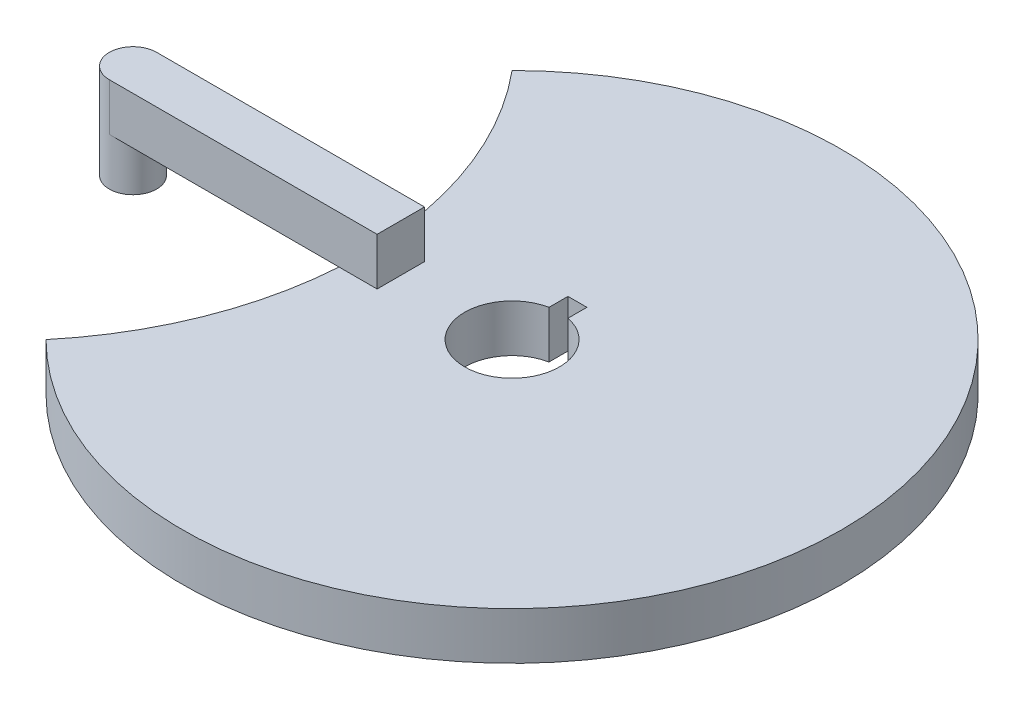
from build123d import *

# Parameters (mm, degrees)
EXTRUDE_1_DEPTH = 10
EXTRUDE_5_DEPTH = 10
EXTRUDE_START   = 10
SKETCH_5_R      = 5
EXTRUDE_6_DEPTH = 10


with BuildPart() as part:
    # 草图1 → 凸台-拉伸1 (new body)
    with BuildSketch(Plane(origin=(0, 0, 0), x_dir=(1, 0, 0), z_dir=(0, 1, 0))):
        with BuildLine():
            ThreePointArc((-49.180194883, -49.180194883), (69.551298604, 0), (-49.180194883, 49.180194883))
            ThreePointArc((-49.180194883, 49.180194883), (-31.357669024, 0), (-49.180194883, -49.180194883))
        make_face()
        with BuildLine():
            Line((-2, 9.797958971), (-2, 13.797958971))
            Line((-2, 13.797958971), (2, 13.797958971))
            Line((2, 13.797958971), (2, 9.797958971))
            ThreePointArc((2, 9.797958971), (0, -10), (-2, 9.797958971))
        make_face(mode=Mode.SUBTRACT)
    extrude(amount=EXTRUDE_1_DEPTH)

    # 草图4 → 凸台-拉伸5 (add)
    with BuildSketch(Plane(origin=(0, 10, 0), x_dir=(1, 0, 0), z_dir=(0, 1, 0))):
        with BuildLine():
            Line((-80, 5), (-23.481338819, 5))
            Line((-23.481338819, 5), (-23.481338819, -5))
            Line((-23.481338819, -5), (-80, -5))
            ThreePointArc((-80, -5), (-85, 0), (-80, 5))
        make_face()
    extrude(amount=EXTRUDE_5_DEPTH)

    # 草图5 → 凸台-拉伸6 (add)
    with BuildSketch(Plane.XZ.offset(-10).offset(EXTRUDE_START)):
        with Locations(Location((-80, 0, 0), (0, 0, 270))):
            Circle(SKETCH_5_R)
    extrude(amount=-EXTRUDE_6_DEPTH)


solid = part.part
